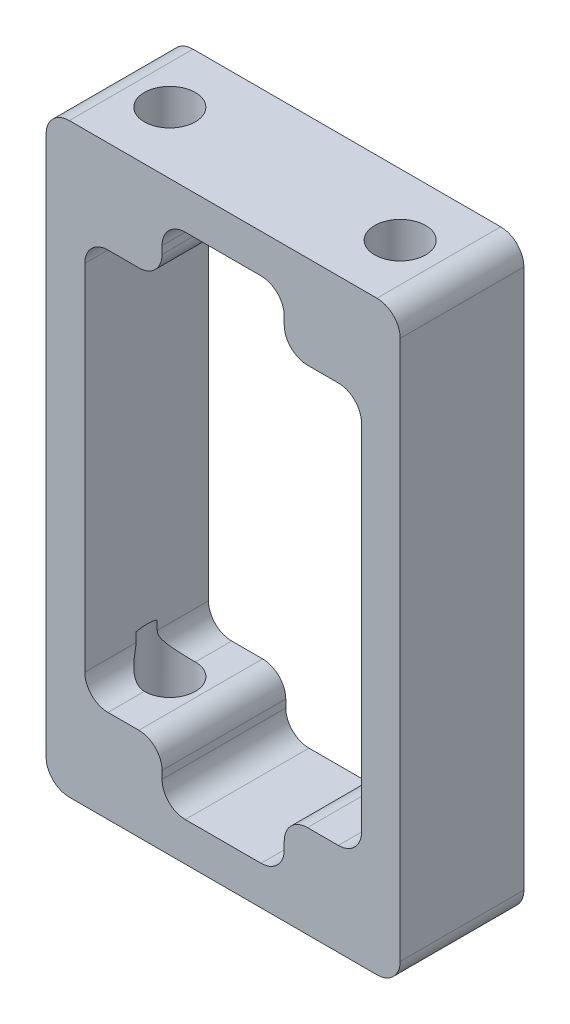
from build123d import *

# Parameters (mm, degrees)
SKETCH_1_W                  = 22.9
SKETCH_1_H                  = 37.9
EXTRUDE_1_DEPTH             = 4
HOLE_WIZARD_M4_1_AT_2_COUNT = 2
HOLE_WIZARD_M4_1_AT_2_PITCH = 14.9
SKETCH_6_W                  = 17.9
SKETCH_6_H                  = 25.9
CUT_EXTRUDE_1_DEPTH         = 19
SKETCH_7_W                  = 7.9
SKETCH_7_H                  = 32.9
CUT_EXTRUDE_2_DEPTH         = 19
FILLET_1_R                  = 1.5
FILLET_2_R                  = 1.5


with BuildPart() as part:
    # 草图1 → 凸台-拉伸1 (new, symmetric)
    with BuildSketch(Plane.XY):
        Rectangle(SKETCH_1_W, SKETCH_1_H)
    extrude(amount=EXTRUDE_1_DEPTH, both=True)

    # 草图5 → M4 螺纹孔1 (revolve, cut)
    with BuildSketch(Plane(origin=(-7.45, 18.95, 0), x_dir=(0, 0, 1), z_dir=(1, 0, 0))):
        Polygon((0, 0), (0, 9.091420021), (1.65, 8.1), (1.65, 0), align=None)
    hole_wizard_m4_1 = revolve(axis=Axis((-7.45, 25.3, 0), (0, -1, 0)), mode=Mode.SUBTRACT)

    # M4 螺纹孔1 at 2: M4 螺纹孔1 ×2
    with Locations(*[(i * HOLE_WIZARD_M4_1_AT_2_PITCH, 0, 0) for i in range(1, HOLE_WIZARD_M4_1_AT_2_COUNT)]):
        add(hole_wizard_m4_1, mode=Mode.SUBTRACT)

    # 镜向1: M4 螺纹孔1 across plane
    add(hole_wizard_m4_1.mirror(Plane.ZX), mode=Mode.SUBTRACT)

    # 镜向1 copy 1 sketch → 镜向1 copy 1 (revolve, cut)
    with BuildSketch(Plane(origin=(7.45, -18.95, 0), x_dir=(0, 0, 1), z_dir=(1, 0, 0))):
        Polygon((0, 0), (0, -9.091420021), (1.65, -8.1), (1.65, 0), align=None)
    revolve(axis=Axis((7.45, -25.3, 0), (0, -1, 0)), mode=Mode.SUBTRACT)

    # 草图6 → 切除-拉伸1 (cut, symmetric)
    with BuildSketch(Plane.XY.offset(4)):
        Rectangle(SKETCH_6_W, SKETCH_6_H)
    extrude(amount=CUT_EXTRUDE_1_DEPTH, both=True, mode=Mode.SUBTRACT)

    # 草图7 → 切除-拉伸2 (cut, symmetric)
    with BuildSketch(Plane.XY.offset(4)):
        Rectangle(SKETCH_7_W, SKETCH_7_H)
    extrude(amount=CUT_EXTRUDE_2_DEPTH, both=True, mode=Mode.SUBTRACT)

    # 圆角1
    fillet_1_edges = [part.edges().sort_by_distance(p)[0] for p in [
        (-8.95, 12.95, 2.343693177),
        (-8.95, 12.95, -2.343693177),
        (8.95, 12.95, 2.343693177),
        (8.95, 12.95, -2.343693177),
        (8.95, -12.95, 2.343693177),
        (8.95, -12.95, -2.343693177),
        (-8.95, -12.95, 2.343693177),
        (-8.95, -12.95, -2.343693177),
        (-3.95, -12.95, 0),
        (3.95, -12.95, 0),
        (3.95, -16.45, 0),
        (-3.95, 16.45, 0),
        (3.95, 16.45, 0),
        (3.95, 12.95, 0),
        (-3.95, 12.95, 0),
        (-3.95, -16.45, 0),
    ]]
    fillet(fillet_1_edges, radius=FILLET_1_R)

    # 圆角2
    fillet_2_edges = [part.edges().sort_by_distance(p)[0] for p in [
        (11.45, -18.95, 0),
        (-11.45, -18.95, 0),
        (-11.45, 18.95, 0),
        (11.45, 18.95, 0),
    ]]
    fillet(fillet_2_edges, radius=FILLET_2_R)


solid = part.part
